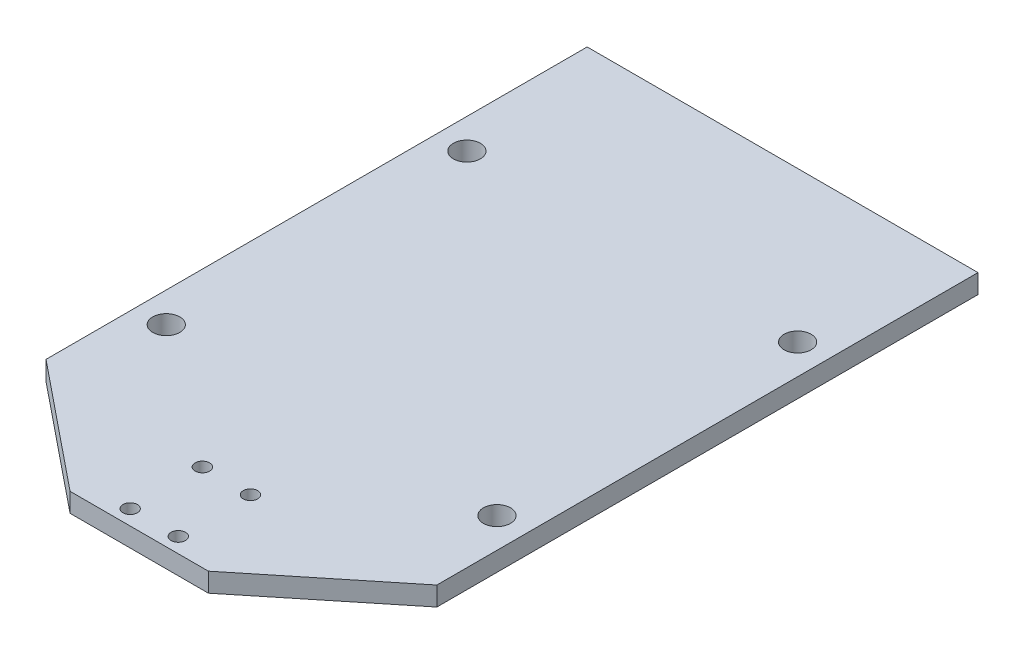
from build123d import *

# Parameters (mm, degrees)
SKETCH1_W            = 65
SKETCH1_H            = 90
SKETCH1_W_2          = 23
SKETCH1_H_2          = 17
BOSS_EXTRUDE1_DEPTH  = 1.5875
M2_CLEARANCE_HOLE1_D = 2.4
M4_CLEARANCE_HOLE1_D = 4.5


with BuildPart() as part:
    # Sketch1 → Boss-Extrude1 (new, symmetric)
    with BuildSketch(Plane(origin=(0, 0, 0), x_dir=(1, 0, 0), z_dir=(0, 1, 0))):
        Polygon((-32.5, -45), (-11.5, -62), (-11.5, -45), align=None)
        Polygon((11.5, -45), (11.5, -62), (32.5, -45), align=None)
        Rectangle(SKETCH1_W, SKETCH1_H)
        with Locations((0, -53.5)):
            Rectangle(SKETCH1_W_2, SKETCH1_H_2)
    extrude(amount=BOSS_EXTRUDE1_DEPTH, both=True)

    # M2 Clearance Hole1 (through all)
    with Locations(Plane(origin=(0, 1.5875, 0), x_dir=(1, 0, 0), z_dir=(0, 1, 0))):
        with Locations((-4, -59.5), (4, -59.5), (4, -47.5), (-4, -47.5)):
            Hole(M2_CLEARANCE_HOLE1_D / 2)

    # M4 Clearance Hole1 (through all)
    with Locations(Plane(origin=(0, 1.5875, 0), x_dir=(1, 0, 0), z_dir=(0, 1, 0))):
        with Locations((-27.5, 20), (27.5, 20), (27.5, -30), (-27.5, -30)):
            Hole(M4_CLEARANCE_HOLE1_D / 2)


solid = part.part
